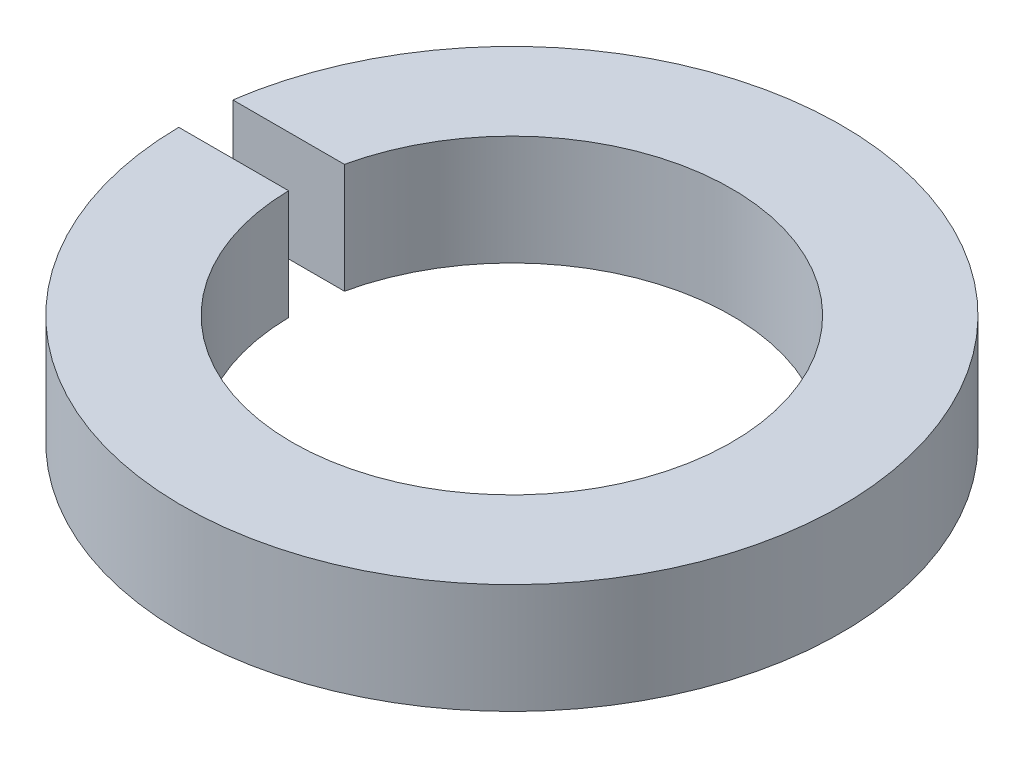
from build123d import *

# Parameters (mm, degrees)
CROQUIS1_R     = 3
CROQUIS1_R_2   = 2
EXTRUIR1_DEPTH = 1
CROQUIS2_W     = 1.99150069
CROQUIS2_H     = 0.461872056
EXTRUIR2_DEPTH = 10


with BuildPart() as part:
    # Croquis1 → Extruir1 (new body)
    with BuildSketch(Plane(origin=(0, 0, 0), x_dir=(1, 0, 0), z_dir=(0, 1, 0))):
        with Locations(Location((0, 0, 0), (0, 0, 270))):
            Circle(CROQUIS1_R)
        with Locations(Location((0, 0, 0), (0, 0, 270))):
            Circle(CROQUIS1_R_2, mode=Mode.SUBTRACT)
    extrude(amount=EXTRUIR1_DEPTH)

    # Croquis2 → Extruir2 (cut)
    with BuildSketch(Plane(origin=(0, 1, 0), x_dir=(1, 0, 0), z_dir=(0, 1, 0))):
        with Locations((-2.337581201, 0.198471685)):
            Rectangle(CROQUIS2_W, CROQUIS2_H)
    extrude(amount=-EXTRUIR2_DEPTH, mode=Mode.SUBTRACT)


solid = part.part
